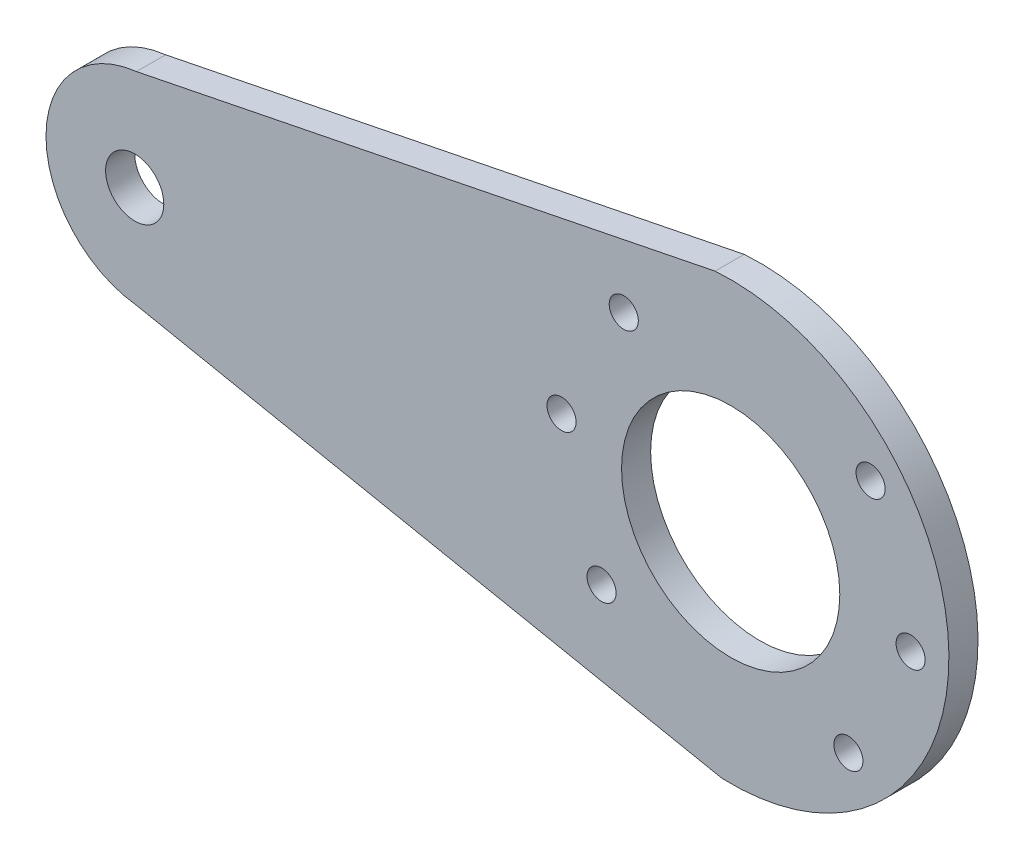
from build123d import *

# Parameters (mm, degrees)
EXTRUDE_START       = -2
SKETCH_1_R          = 15
SKETCH_1_R_2        = 4
EXTRUDE_1_DEPTH     = 4
SKETCH_2_R          = 2
CUT_EXTRUDE_1_DEPTH = 99.856382383


with BuildPart() as part:
    # Эскиз1 → Вытянуть1 (new body)
    with BuildSketch(Plane.XY.offset(EXTRUDE_START)):
        with BuildLine():
            Line((-81.676846175, 13.911980398), (-2.13800288, 29.923718748))
            ThreePointArc((-2.13800288, 29.923718748), (29.996326682, 0.469452404), (-1.200553025, -29.975968248))
            Line((-1.200553025, -29.975968248), (-81.702325517, -13.909086088))
            ThreePointArc((-81.702325517, -13.909086088), (-94.109421594, 0.012821602), (-81.676846175, 13.911980398))
        make_face()
        Circle(SKETCH_1_R, mode=Mode.SUBTRACT)
        with Locations((-81.917641848, 0)):
            Circle(SKETCH_1_R_2, mode=Mode.SUBTRACT)
    extrude(amount=EXTRUDE_1_DEPTH)

    # Эскиз2 → Вырез-Вытянуть1 (cut, through all)
    with BuildSketch(Plane.XY.offset(2)):
        with Locations((-17.747047674, -15.205235902)):
            Circle(SKETCH_2_R)
        with Locations((-23.247368562, 2.390973642)):
            Circle(SKETCH_2_R)
        with Locations((-14.694283668, 18.722686931)):
            Circle(SKETCH_2_R)
        with Locations((19.233639165, 15.669922925)):
            Circle(SKETCH_2_R)
        with Locations((24.733960053, -1.926286619)):
            Circle(SKETCH_2_R)
        with Locations((16.180875159, -18.257999908)):
            Circle(SKETCH_2_R)
    extrude(amount=-CUT_EXTRUDE_1_DEPTH, mode=Mode.SUBTRACT)


solid = part.part
